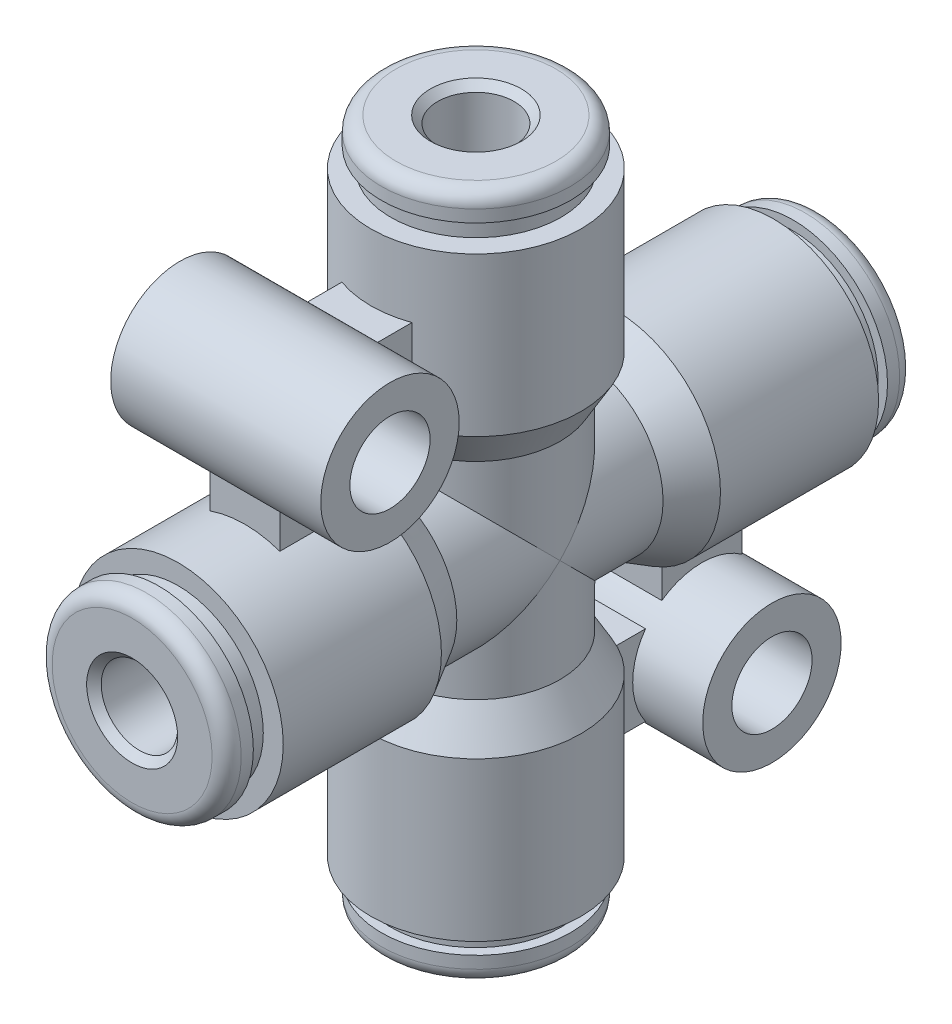
from build123d import *
from build123d.topology import SkipClean

# Parameters (mm, degrees)
CIRPATTERN1_COUNT     = 4
CIRPATTERN2_COUNT     = 4
SKETCH4_R             = 3.624
SKETCH4_R_2           = 2.1
BOSS_EXTRUDE1_DEPTH   = 5.5
BOSS_EXTRUDE1_2_DEPTH = 5.5
BOSS_EXTRUDE2_DEPTH   = 1.833333333


with BuildPart() as part:
    # Sketch1 → Revolve1 (revolve)
    with BuildSketch(Plane(origin=(0, 0, 0), x_dir=(0, 0, -1), z_dir=(1, 0, 0))):
        with BuildLine():
            Line((16.603, 4.95), (17.238, 4.95))
            ThreePointArc((17.238, 4.95), (17.776815367, 4.726815367), (18, 4.188))
            Line((18, 4.188), (18, 2.381))
            Line((18, 2.381), (17.619, 2))
            Line((17.619, 2), (7.714285714, 2))
            Line((7.714285714, 2), (7.714285714, 1.238))
            Line((7.714285714, 1.238), (0, 1.238))
            Line((0, 1.238), (0, 4.4))
            Line((0, 4.4), (5.4, 4.4))
            Line((5.4, 4.4), (7.305255888, 5.5))
            Line((7.305255888, 5.5), (15.587, 5.5))
            Line((15.587, 5.5), (15.587, 4.455))
            Line((15.587, 4.455), (16.603, 4.455))
            Line((16.603, 4.455), (16.603, 4.95))
        make_face()
    revolve(axis=Axis((0, 0, 0), (0, 0, -1)))


with BuildPart() as cirpattern1_1:
    # CirPattern1: pattern copy
    add(part.part.rotate(Axis((-6.05, 0, 0), (1, 0, 0)), 1 * 360 / CIRPATTERN1_COUNT))


with BuildPart() as cirpattern1_2:
    # CirPattern1: pattern copy
    add(part.part.rotate(Axis((-6.05, 0, 0), (1, 0, 0)), 2 * 360 / CIRPATTERN1_COUNT))


with BuildPart() as cirpattern1_3:
    # CirPattern1: pattern copy
    add(part.part.rotate(Axis((-6.05, 0, 0), (1, 0, 0)), 3 * 360 / CIRPATTERN1_COUNT))


with BuildPart() as part_1:
    add(part.part)

    # Combine1: union CirPattern1_1, CirPattern1_2, CirPattern1_3
    add(cirpattern1_1.part)
    add(cirpattern1_2.part)
    add(cirpattern1_3.part)

    # Sketch3 → Cut-Revolve1 (revolve, cut)
    with BuildSketch(Plane(origin=(0, 0, 0), x_dir=(0, 0, -1), z_dir=(1, 0, 0))):
        Polygon((18, 2.381), (17.619, 2), (7.714285714, 2), (7.714285714, 1.238), (0, 1.238), (0, 0), (18, 0), align=None)
    cut_revolve1 = revolve(axis=Axis((0, 0, 0), (0, 0, -1)), mode=Mode.SUBTRACT)

    # CirPattern2: Cut-Revolve1 ×4 about axis
    cirpattern2_axis = Axis((-6.05, 0, 0), (1, 0, 0))
    for i in range(1, CIRPATTERN2_COUNT):
        add(cut_revolve1.rotate(cirpattern2_axis, i * 360 / CIRPATTERN2_COUNT), mode=Mode.SUBTRACT)



with BuildPart() as body_2:
    # Sketch4 → Boss-Extrude1 (new, symmetric)
    with BuildSketch(Plane(origin=(0, 0, 0), x_dir=(0, 0, -1), z_dir=(1, 0, 0))):
        with Locations((-10, 10)):
            Circle(SKETCH4_R)
        with Locations((-10, 10)):
            Circle(SKETCH4_R_2, mode=Mode.SUBTRACT)
    extrude(amount=BOSS_EXTRUDE1_DEPTH, both=True)


with BuildPart() as body_3:
    # Sketch4 → Boss-Extrude1 2 (new, symmetric)
    with BuildSketch(Plane(origin=(0, 0, 0), x_dir=(0, 0, -1), z_dir=(1, 0, 0))):
        with Locations((10, -10)):
            Circle(SKETCH4_R)
        with Locations((10, -10)):
            Circle(SKETCH4_R_2, mode=Mode.SUBTRACT)
    extrude(amount=BOSS_EXTRUDE1_2_DEPTH, both=True)


with BuildPart() as part_2:
    with SkipClean():  # the faces are left unmerged after this step: merging them gives an invalid solid
        add(part_1.part)

        add(body_2.part)  # Boss-Extrude2 merges body 2

        add(body_3.part)  # Boss-Extrude2 merges body 3
        # Sketch5 → Boss-Extrude2 (add, symmetric)
        with BuildSketch(Plane(origin=(0, 0, 0), x_dir=(0, 0, -1), z_dir=(1, 0, 0))):
            with BuildLine():
                Line((10, -12.1), (2, -12.1))
                Line((2, -12.1), (2, -7.9))
                Line((2, -7.9), (7.9, -7.9))
                Line((7.9, -7.9), (7.9, -2))
                Line((7.9, -2), (12.1, -2))
                Line((12.1, -2), (12.1, -10))
                ThreePointArc((12.1, -10), (8.51507576, -8.51507576), (10, -12.1))
            make_face()
            with BuildLine():
                Line((-10, 12.1), (-2, 12.1))
                Line((-2, 12.1), (-2, 7.9))
                Line((-2, 7.9), (-7.9, 7.9))
                Line((-7.9, 7.9), (-7.9, 2))
                Line((-7.9, 2), (-12.1, 2))
                Line((-12.1, 2), (-12.1, 10))
                ThreePointArc((-12.1, 10), (-8.51507576, 8.51507576), (-10, 12.1))
            make_face()
        extrude(amount=BOSS_EXTRUDE2_DEPTH, both=True)


solid = part_2.part
